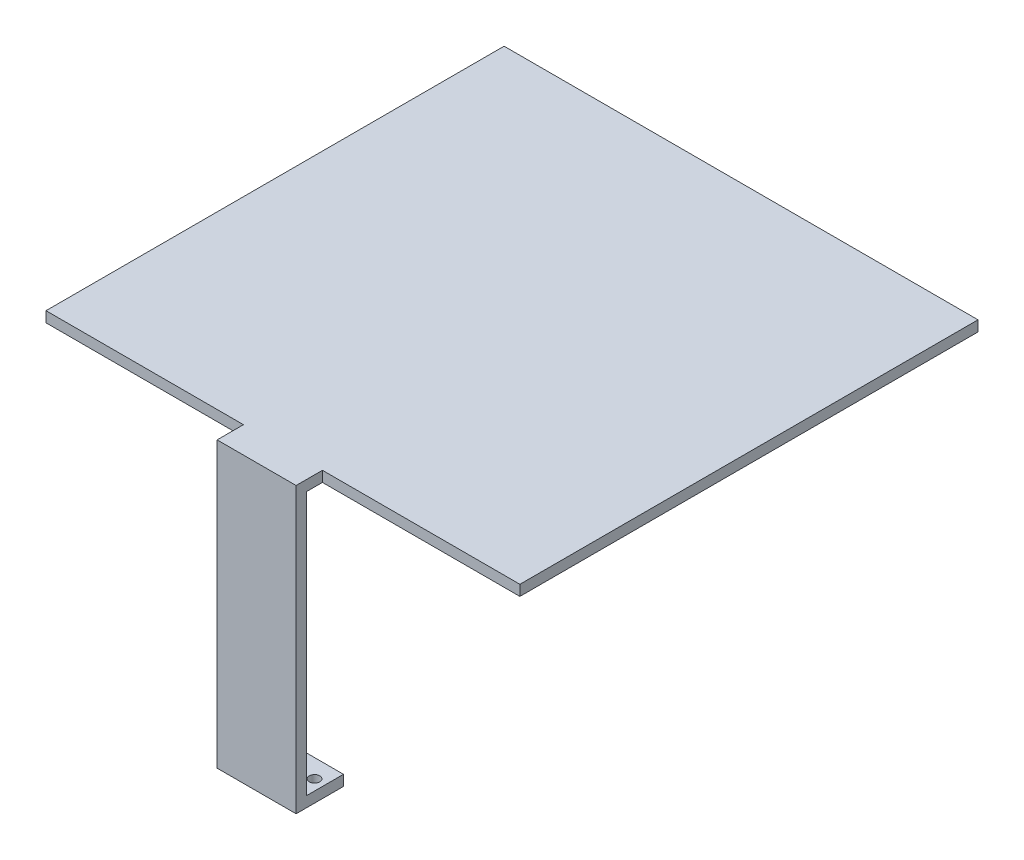
from build123d import *

# Parameters (mm, degrees)
BOSS_EXTRUDE1_DEPTH = 7.5
SKETCH1_4_W         = 87
SKETCH1_4_H         = 2
BOSS_EXTRUDE2_DEPTH = 45
SKETCH2_R           = 1
CUT_EXTRUDE1_DEPTH  = 108.786826653


with BuildPart() as part:
    # Sketch1 → Boss-Extrude1 (new, symmetric)
    with BuildSketch(Plane(origin=(0, 0, 0), x_dir=(0, 0, -1), z_dir=(1, 0, 0))):
        Polygon((0, 0), (-7, 0), (-7, 50), (83, 50), (83, 52), (-9, 52), (-9, -2), (0, -2), align=None)
    extrude(amount=BOSS_EXTRUDE1_DEPTH, both=True)

    # Sketch1<4> → Boss-Extrude2 (add, symmetric)
    with BuildSketch(Plane(origin=(0, 0, 0), x_dir=(0, 0, -1), z_dir=(1, 0, 0))):
        with Locations((39.5, 51)):
            Rectangle(SKETCH1_4_W, SKETCH1_4_H)
    extrude(amount=BOSS_EXTRUDE2_DEPTH, both=True)

    # Sketch2 → Cut-Extrude1 (cut, through all)
    with BuildSketch(Plane(origin=(0, 0, 0), x_dir=(1, 0, 0), z_dir=(0, 1, 0))):
        with Locations((-5.5, -3.5)):
            Circle(SKETCH2_R)
        with Locations((5.5, -3.5)):
            Circle(SKETCH2_R)
    extrude(amount=-CUT_EXTRUDE1_DEPTH, mode=Mode.SUBTRACT)


solid = part.part
